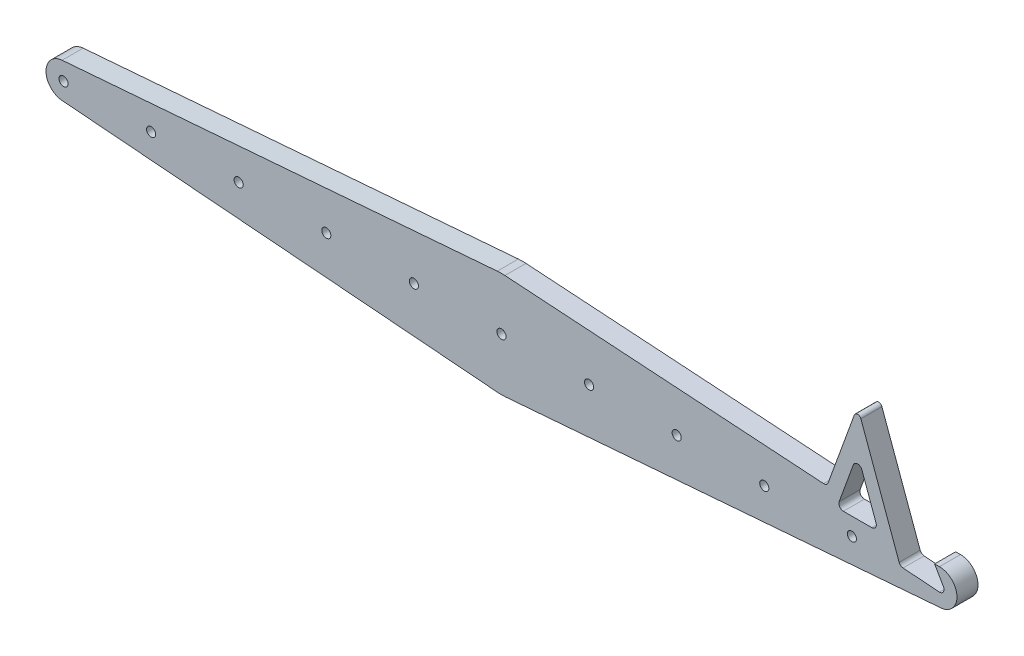
from build123d import *

# Parameters (mm, degrees)
SKETCH1_R           = 5
BOSS_EXTRUDE1_DEPTH = 6
SKETCH2_R           = 1.3
CUT_EXTRUDE1_DEPTH  = 256.119579805
LPATTERN1_COUNT     = 10
LPATTERN1_PITCH     = 25
CUT_EXTRUDE3_DEPTH  = 256.119579805
BOSS_EXTRUDE2_DEPTH = 6
CUT_EXTRUDE4_DEPTH  = 257.947465448
BOSS_EXTRUDE3_DEPTH = 6


with BuildPart() as part:
    # Sketch1 → Boss-Extrude1 (new body)
    with BuildSketch(Plane.XY):
        with BuildLine():
            Line((250, 5), (0, 5))
            ThreePointArc((0, 5), (3.535533906, 3.535533906), (5, 0))
            ThreePointArc((5, 0), (3.535533906, -3.535533906), (0, -5))
            Line((0, -5), (250, -5))
            ThreePointArc((250, -5), (245, 0), (250, 5))
        make_face()
        with Locations((250, 0)):
            Circle(SKETCH1_R)
        Circle(SKETCH1_R)
    extrude(amount=BOSS_EXTRUDE1_DEPTH)

    # Sketch2 → Cut-Extrude1 (cut, through all)
    with BuildSketch(Plane.XY.offset(6)):
        Circle(SKETCH2_R)
        with Locations((250, 0)):
            Circle(SKETCH2_R)
    cut_extrude1 = extrude(amount=-CUT_EXTRUDE1_DEPTH, mode=Mode.SUBTRACT)

    # LPattern1: Cut-Extrude1 ×10
    with Locations(*[(i * LPATTERN1_PITCH, 0, 0) for i in range(1, LPATTERN1_COUNT)]):
        add(cut_extrude1, mode=Mode.SUBTRACT)

    # Sketch3 → Cut-Extrude3 (cut, through all)
    with BuildSketch(Plane.XY.offset(6)):
        with BuildLine():
            ThreePointArc((250, -1.3), (248.874166975, 0.65), (251.125833025, 0.65))
            Line((251.125833025, 0.65), (248.614359354, 5))
            Line((248.614359354, 5), (236.796717724, 5))
            Line((236.796717724, 5), (238.778399593, -0.444626186))
            ThreePointArc((238.778399593, -0.444626186), (239.254350633, -1.064897658), (240, -1.3))
            Line((240, -1.3), (250, -1.3))
        make_face()
    extrude(amount=-CUT_EXTRUDE3_DEPTH, mode=Mode.SUBTRACT)

    # Sketch3<4> → Boss-Extrude2 (add, through all)
    with BuildSketch(Plane.XY.offset(6)):
        with BuildLine():
            Line((216.469850466, 5), (236.796717724, 5))
            Line((236.796717724, 5), (227.572976716, 30.342020143))
            ThreePointArc((227.572976716, 30.342020143), (226.633284095, 31), (225.693591475, 30.342020143))
            Line((225.693591475, 30.342020143), (216.469850466, 5))
        make_face()
    extrude(amount=-BOSS_EXTRUDE2_DEPTH)

    # Sketch4 → Cut-Extrude4 (cut, through all)
    with BuildSketch(Plane.XY.offset(6)):
        with BuildLine():
            Line((225.411683688, 17.872267266), (221.361553558, 6.744626186))
            ThreePointArc((221.361553558, 6.744626186), (221.518256307, 5.554350633), (222.583153965, 5))
            Line((222.583153965, 5), (230.683414226, 5))
            ThreePointArc((230.683414226, 5), (231.748311883, 5.554350633), (231.905014633, 6.744626186))
            Line((231.905014633, 6.744626186), (227.854884502, 17.872267266))
            ThreePointArc((227.854884502, 17.872267266), (226.633284095, 18.727641079), (225.411683688, 17.872267266))
        make_face()
    extrude(amount=-CUT_EXTRUDE4_DEPTH, mode=Mode.SUBTRACT)

    # Sketch5 → Boss-Extrude3 (add, through all)
    with BuildSketch(Plane.XY.offset(6)):
        with BuildLine():
            ThreePointArc((110.857864376, 5), (115.8563971, 11.890943024), (123.8, 14.951922953))
            Line((123.8, 14.951922953), (-0.4, 4.983974318))
            ThreePointArc((-0.4, 4.983974318), (-0.20016045, 4.995991973), (0, 5))
            Line((0, 5), (110.857864376, 5))
        make_face()
        with BuildLine():
            ThreePointArc((0, -5), (-0.20016045, -4.995991973), (-0.4, -4.983974318))
            Line((-0.4, -4.983974318), (123.8, -14.951922953))
            ThreePointArc((123.8, -14.951922953), (115.8563971, -11.890943024), (110.857864376, -5))
            Line((110.857864376, -5), (0, -5))
        make_face()
        with BuildLine():
            ThreePointArc((125.982164337, 14.967810568), (124.890792866, 14.999602455), (123.8, 14.951922953))
            ThreePointArc((123.8, 14.951922953), (115.8563971, 11.890943024), (110.857864376, 5))
            Line((110.857864376, 5), (139.142135624, 5))
            ThreePointArc((139.142135624, 5), (134.056788847, 11.957197656), (125.982164337, 14.967810568))
        make_face()
        with BuildLine():
            Line((139.142135624, -5), (110.857864376, -5))
            ThreePointArc((110.857864376, -5), (115.8563971, -11.890943024), (123.8, -14.951922953))
            ThreePointArc((123.8, -14.951922953), (125, -15), (126.2, -14.951922953))
            ThreePointArc((126.2, -14.951922953), (134.1436029, -11.890943024), (139.142135624, -5))
        make_face()
        with BuildLine():
            Line((250, -5), (139.142135624, -5))
            ThreePointArc((139.142135624, -5), (134.1436029, -11.890943024), (126.2, -14.951922953))
            Line((126.2, -14.951922953), (250.4, -4.983974318))
            ThreePointArc((250.4, -4.983974318), (250.20016045, -4.995991973), (250, -5))
        make_face()
        with BuildLine():
            Line((216.929325308, 9), (125.982164337, 14.967810568))
            ThreePointArc((125.982164337, 14.967810568), (134.056788847, 11.957197656), (139.142135624, 5))
            Line((139.142135624, 5), (216.469850466, 5))
            Line((216.469850466, 5), (218.236046624, 9.852584063))
            ThreePointArc((218.236046624, 9.852584063), (217.724813241, 9.208459271), (216.929325308, 9))
        make_face()
        with BuildLine():
            Line((240, -1.3), (250, -1.3))
            Line((250, -1.3), (239.61442594, -0.50835284))
            ThreePointArc((239.61442594, -0.50835284), (238.927624535, -0.247883379), (238.491632246, 0.343260625))
            Line((238.491632246, 0.343260625), (238.778399593, -0.444626186))
            ThreePointArc((238.778399593, -0.444626186), (239.254350633, -1.064897658), (240, -1.3))
        make_face()
    extrude(amount=-BOSS_EXTRUDE3_DEPTH)


solid = part.part
